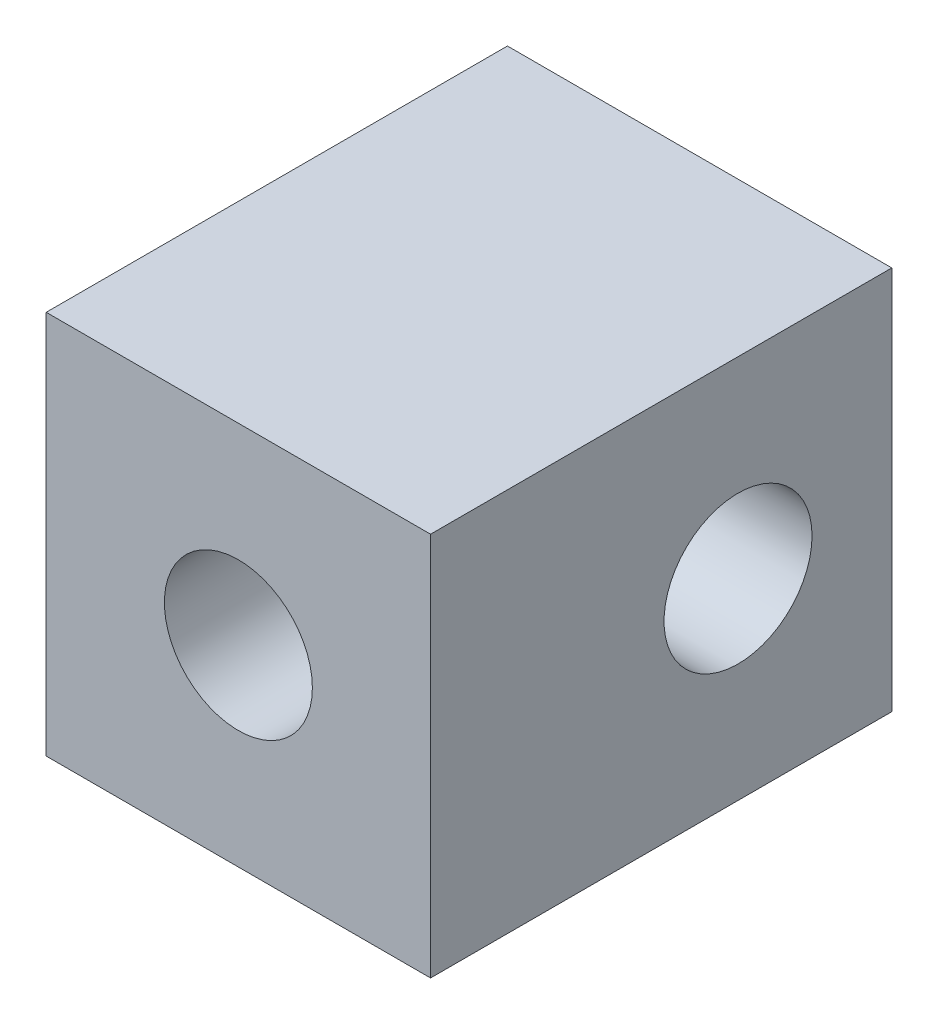
from build123d import *

# Parameters (mm, degrees)
SKETCH2_W           = 10
SKETCH2_H           = 12
BOSS_EXTRUDE1_DEPTH = 10
SKETCH3_R           = 1.925
CUT_EXTRUDE1_DEPTH  = 4.5
SKETCH4_R           = 1.925
CUT_EXTRUDE2_DEPTH  = 10


with BuildPart() as part:
    # Sketch2 → Boss-Extrude1 (new body)
    with BuildSketch(Plane(origin=(0, 0, 0), x_dir=(1, 0, 0), z_dir=(0, 1, 0))):
        with Locations((-18.157041848, 40.649833306)):
            Rectangle(SKETCH2_W, SKETCH2_H)
    extrude(amount=BOSS_EXTRUDE1_DEPTH)

    # Sketch3 → Cut-Extrude1 (cut)
    with BuildSketch(Plane.XY.offset(-34.649833306)):
        with Locations((-18.157041848, 5)):
            Circle(SKETCH3_R)
    extrude(amount=-CUT_EXTRUDE1_DEPTH, mode=Mode.SUBTRACT)

    # Sketch4 → Cut-Extrude2 (cut)
    with BuildSketch(Plane(origin=(-13.157041848, 0, 0), x_dir=(0, 0, -1), z_dir=(1, 0, 0))):
        with Locations((42.649833306, 5)):
            Circle(SKETCH4_R)
    extrude(amount=-CUT_EXTRUDE2_DEPTH, mode=Mode.SUBTRACT)


solid = part.part
